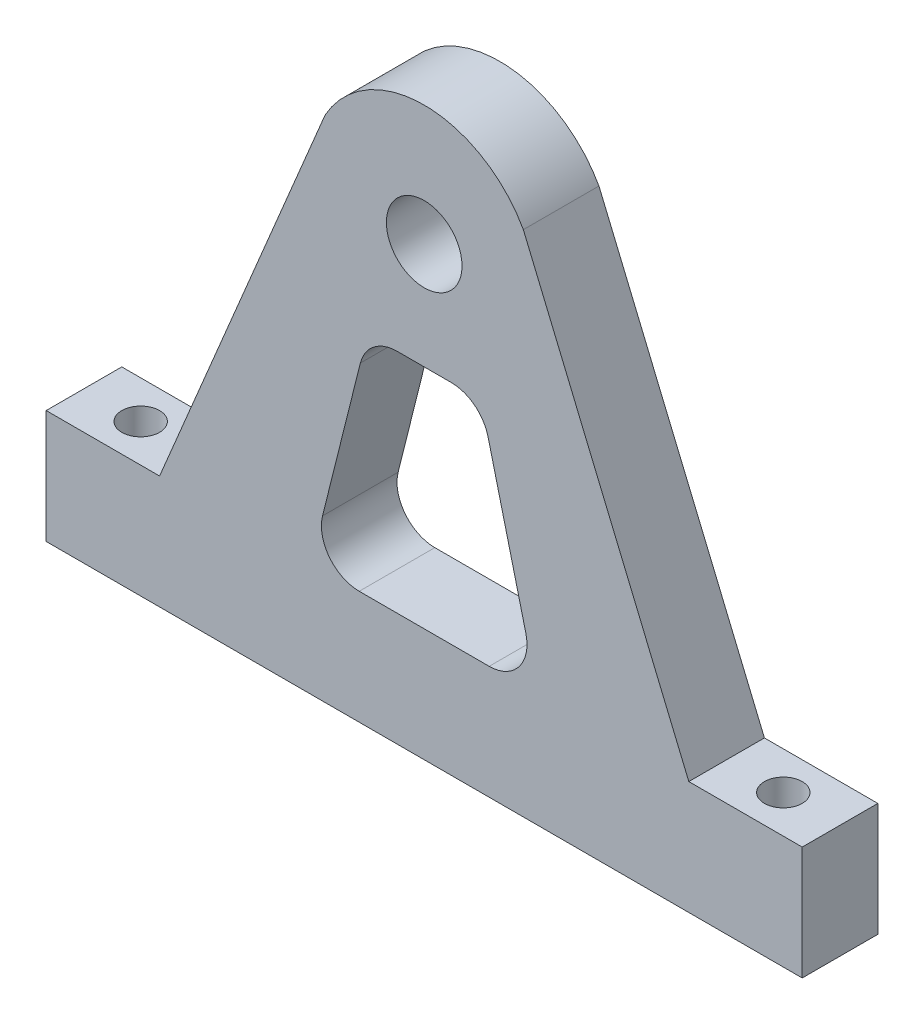
from build123d import *

# Parameters (mm, degrees)
SKETCH1_R           = 5
BOSS_EXTRUDE2_DEPTH = 10
CUT_EXTRUDE1_DEPTH  = 25
SKETCH4_R           = 2.5
CUT_EXTRUDE2_DEPTH  = 38


with BuildPart() as part:
    # Sketch1 → Boss-Extrude2 (new body)
    with BuildSketch(Plane.XY):
        with BuildLine():
            Line((35, 15), (13.114987511, 67.279910892))
            ThreePointArc((13.114987511, 67.279910892), (0, 75), (-13.114987511, 67.279910892))
            Line((-13.114987511, 67.279910892), (-35, 15))
            Line((-35, 15), (-50, 15))
            Line((-50, 15), (-50, 0))
            Line((-50, 0), (-35, 0))
            Line((-35, 0), (35, 0))
            Line((35, 0), (50, 0))
            Line((50, 0), (50, 15))
            Line((50, 15), (35, 15))
        make_face()
        with Locations((0, 59.06)):
            Circle(SKETCH1_R, mode=Mode.SUBTRACT)
    extrude(amount=BOSS_EXTRUDE2_DEPTH)

    # Sketch3 → Cut-Extrude1 (cut)
    with BuildSketch(Plane(origin=(0, 0, 0), x_dir=(-1, 0, 0), z_dir=(0, 0, -1))):
        with BuildLine():
            Line((0, 15), (-8.596117968, 15))
            ThreePointArc((-8.596117968, 15), (-12.537145158, 16.922938953), (-13.446830469, 21.212678125))
            Line((-13.446830469, 21.212678125), (-8.446830469, 41.212678125))
            ThreePointArc((-8.446830469, 41.212678125), (-6.673179015, 43.94102719), (-3.596117968, 45))
            Line((-3.596117968, 45), (0, 45))
            Line((0, 45), (3.596117968, 45))
            ThreePointArc((3.596117968, 45), (6.673179015, 43.94102719), (8.446830469, 41.212678125))
            Line((8.446830469, 41.212678125), (13.446830469, 21.212678125))
            ThreePointArc((13.446830469, 21.212678125), (12.537145158, 16.922938953), (8.596117968, 15))
            Line((8.596117968, 15), (0, 15))
        make_face()
    extrude(amount=-CUT_EXTRUDE1_DEPTH, mode=Mode.SUBTRACT)

    # Sketch4 → Cut-Extrude2 (cut)
    with BuildSketch(Plane(origin=(0, 15, 0), x_dir=(1, 0, 0), z_dir=(0, 1, 0))):
        with Locations(Location((-42.5, -5, 0), (0, 0, 270))):
            Circle(SKETCH4_R)
        with Locations(Location((42.5, -5, 0), (0, 0, 180))):
            Circle(SKETCH4_R)
    extrude(amount=-CUT_EXTRUDE2_DEPTH, mode=Mode.SUBTRACT)


solid = part.part
